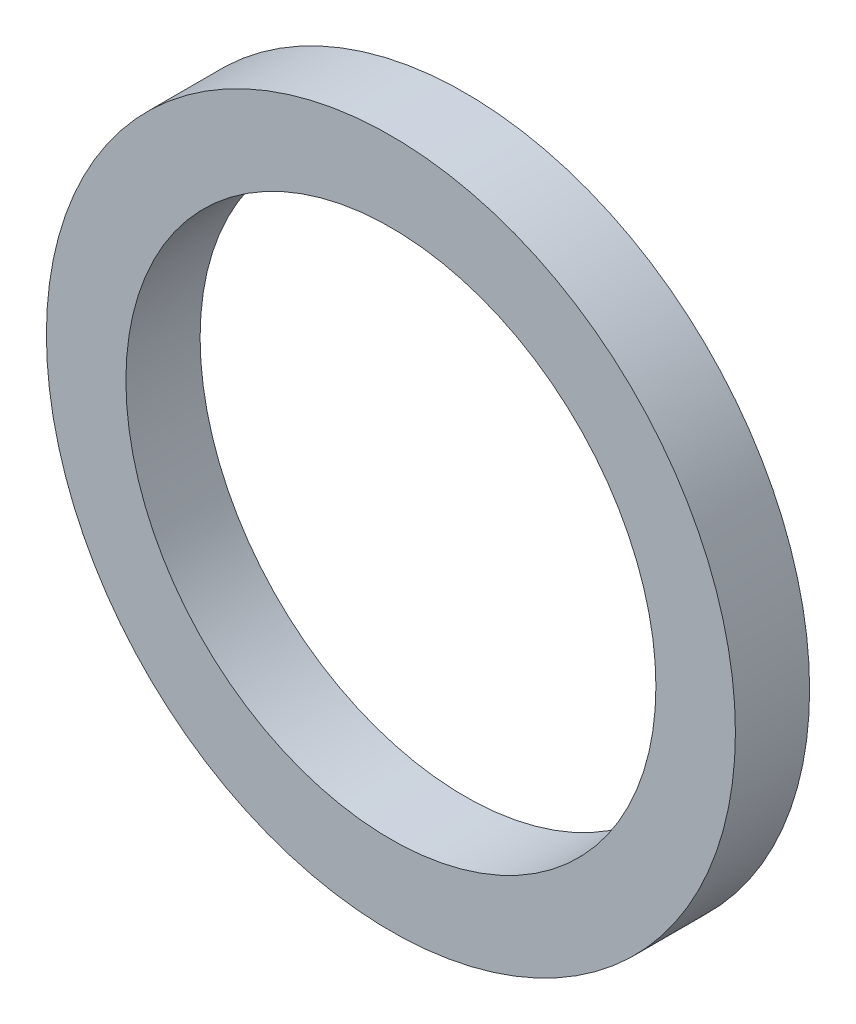
from build123d import *

# Parameters (mm, degrees)
SKETCH1_R           = 32.5
SKETCH1_R_2         = 25
BOSS_EXTRUDE1_DEPTH = 7


with BuildPart() as part:
    # Sketch1 → Boss-Extrude1 (new body)
    with BuildSketch(Plane.XY):
        Circle(SKETCH1_R)
        Circle(SKETCH1_R_2, mode=Mode.SUBTRACT)
    extrude(amount=BOSS_EXTRUDE1_DEPTH)


solid = part.part
